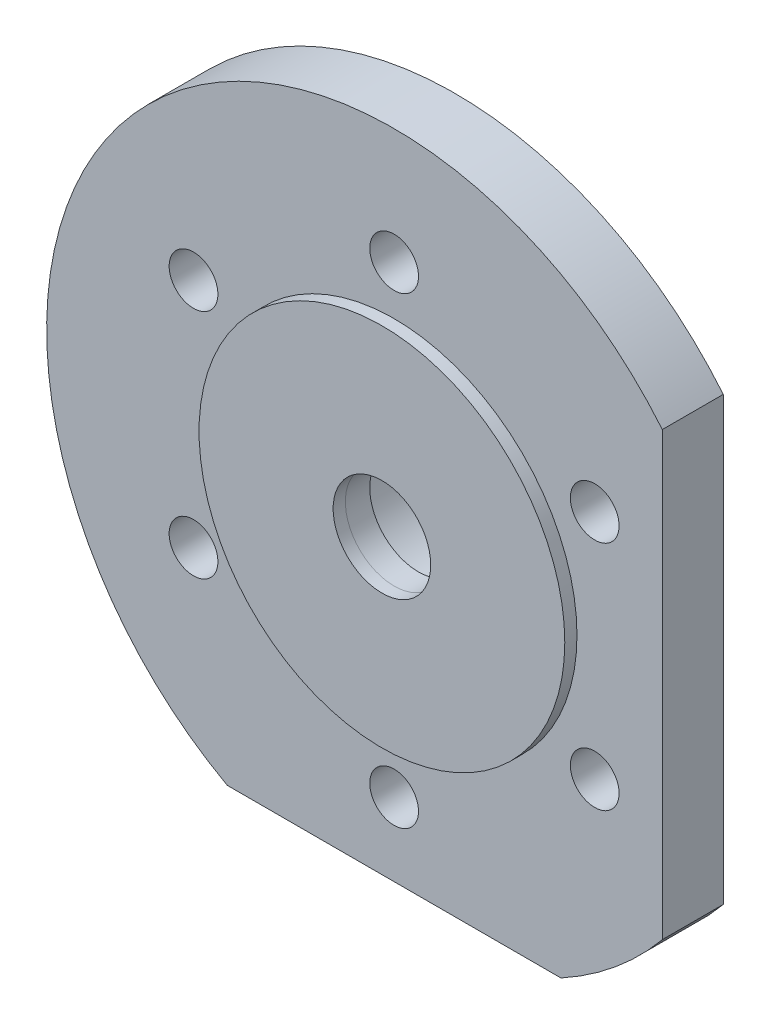
from build123d import *

# Parameters (mm, degrees)
SKETCH1_R           = 15
SKETCH1_R_2         = 4
BOSS_EXTRUDE1_DEPTH = 1
SKETCH1_4_R         = 2
SKETCH1_4_R_2       = 15
BOSS_EXTRUDE2_DEPTH = 5
BOSS_EXTRUDE3_START = -12
SKETCH1_6_R         = 15
SKETCH1_6_R_2       = 6
BOSS_EXTRUDE3_DEPTH = 12
BOSS_EXTRUDE4_START = -2
SKETCH1_7_R         = 6
SKETCH1_7_R_2       = 4
BOSS_EXTRUDE4_DEPTH = 2


with BuildPart() as part:
    # Sketch1 → Boss-Extrude1 (new body)
    with BuildSketch(Plane.XY):
        Circle(SKETCH1_R)
        Circle(SKETCH1_R_2, mode=Mode.SUBTRACT)
    extrude(amount=BOSS_EXTRUDE1_DEPTH)


with BuildPart() as body_2:
    # Sketch1<4> → Boss-Extrude2 (new body)
    with BuildSketch(Plane.XY):
        with BuildLine():
            Line((22, -18.117670932), (22, 18.117670932))
            ThreePointArc((22, 18.117670932), (-21.956152501, 18.170783345), (-13.683932183, -25))
            Line((-13.683932183, -25), (13.683932183, -25))
            ThreePointArc((13.683932183, -25), (18.170783345, -21.956152501), (22, -18.117670932))
        make_face()
        with Locations((-16.454482672, -9.5)):
            Circle(SKETCH1_4_R, mode=Mode.SUBTRACT)
        with Locations((0, -19)):
            Circle(SKETCH1_4_R, mode=Mode.SUBTRACT)
        Circle(SKETCH1_4_R_2, mode=Mode.SUBTRACT)
        with Locations((16.454482672, -9.5)):
            Circle(SKETCH1_4_R, mode=Mode.SUBTRACT)
        with Locations((-16.454482672, 9.5)):
            Circle(SKETCH1_4_R, mode=Mode.SUBTRACT)
        with Locations((16.454482672, 9.5)):
            Circle(SKETCH1_4_R, mode=Mode.SUBTRACT)
        with Locations((0, 19)):
            Circle(SKETCH1_4_R, mode=Mode.SUBTRACT)
    extrude(amount=-BOSS_EXTRUDE2_DEPTH)

    # Sketch1<6> → Boss-Extrude3 (add)
    with BuildSketch(Plane.XY.offset(BOSS_EXTRUDE3_START)):
        Circle(SKETCH1_6_R)
        Circle(SKETCH1_6_R_2, mode=Mode.SUBTRACT)
    extrude(amount=BOSS_EXTRUDE3_DEPTH)

    # Sketch1<7> → Boss-Extrude4 (add)
    with BuildSketch(Plane.XY.offset(BOSS_EXTRUDE4_START)):
        Circle(SKETCH1_7_R)
        Circle(SKETCH1_7_R_2, mode=Mode.SUBTRACT)
    extrude(amount=BOSS_EXTRUDE4_DEPTH)


solid = Compound([part.part, body_2.part])
